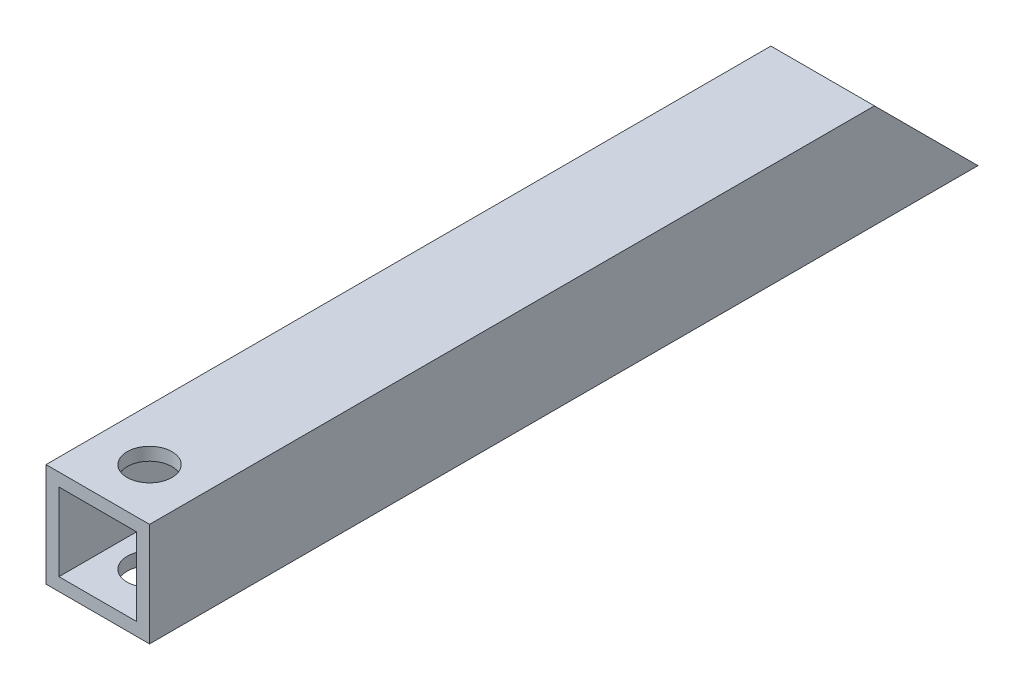
from build123d import *

# Parameters (mm, degrees)
SKETCH1_W             = 25.4
SKETCH1_H             = 25.4
SKETCH1_W_2           = 19.05
SKETCH1_H_2           = 19.05
BOSS_EXTRUDE1_DEPTH   = 203.2
CUT_EXTRUDE1_DEPTH    = 206.174779152
M10_CLEARANCE_HOLE1_D = 11


with BuildPart() as part:
    # Sketch1 → Boss-Extrude1 (new body)
    with BuildSketch(Plane.XY):
        Rectangle(SKETCH1_W, SKETCH1_H)
        Rectangle(SKETCH1_W_2, SKETCH1_H_2, mode=Mode.SUBTRACT)
    extrude(amount=BOSS_EXTRUDE1_DEPTH)

    # Sketch2 → Cut-Extrude1 (cut, through all)
    with BuildSketch(Plane(origin=(12.7, 0, 0), x_dir=(0, 0, -1), z_dir=(1, 0, 0))):
        Polygon((0, 12.7), (0, -12.7), (-25.4, 12.7), align=None)
    extrude(amount=-CUT_EXTRUDE1_DEPTH, mode=Mode.SUBTRACT)

    # M10 Clearance Hole1 (through all)
    with Locations(Plane(origin=(0, -12.7, 0), x_dir=(-1, 0, 0), z_dir=(0, -1, 0))):
        with Locations((0, -190.5)):
            Hole(M10_CLEARANCE_HOLE1_D / 2)


solid = part.part
